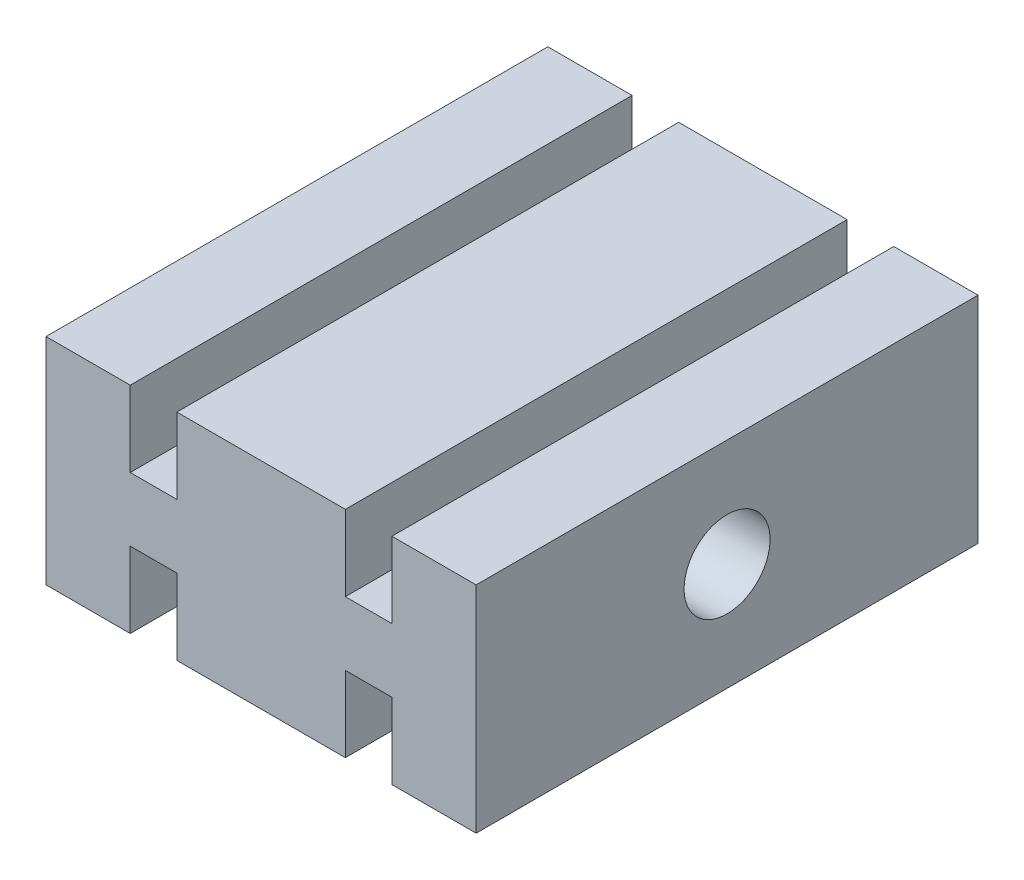
from build123d import *

# Parameters (mm, degrees)
SKETCH1_W               = 60
SKETCH1_H               = 30
BOSS_EXTRUDE1_DEPTH     = 35
CUT_EXTRUDE1_DEPTH      = 49.476798574
CUT_EXTRUDE1_DEPTH_BACK = 49.476798574
SKETCH3_W               = 6.5
SKETCH3_H               = 10.55
CUT_EXTRUDE2_DEPTH      = 72.063352018
CUT_EXTRUDE2_DEPTH_BACK = 72.063352018
SKETCH4_R               = 6


with BuildPart() as part:
    # Sketch1 → Boss-Extrude1 (new, symmetric)
    with BuildSketch(Plane.XY):
        Rectangle(SKETCH1_W, SKETCH1_H)
    extrude(amount=BOSS_EXTRUDE1_DEPTH, both=True)

    # Sketch3 → Cut-Extrude1 (cut, two sides: drawn at the far end of the back side and taken through both)
    with BuildSketch(Plane.XY.offset(-CUT_EXTRUDE1_DEPTH_BACK)):
        with Locations((15, 9.725)):
            Rectangle(SKETCH3_W, SKETCH3_H)
        with Locations((-15, 9.725)):
            Rectangle(SKETCH3_W, SKETCH3_H)
        with Locations((-15, -9.725)):
            Rectangle(SKETCH3_W, SKETCH3_H)
        with Locations((15, -9.725)):
            Rectangle(SKETCH3_W, SKETCH3_H)
    extrude(amount=CUT_EXTRUDE1_DEPTH + CUT_EXTRUDE1_DEPTH_BACK, mode=Mode.SUBTRACT)

    # Sketch4 → Cut-Extrude2 (cut, two sides: drawn at the far end of the back side and taken through both)
    with BuildSketch(Plane.ZY.offset(30).offset(-CUT_EXTRUDE2_DEPTH_BACK)):
        Circle(SKETCH4_R)
    extrude(amount=CUT_EXTRUDE2_DEPTH + CUT_EXTRUDE2_DEPTH_BACK, mode=Mode.SUBTRACT)


solid = part.part
